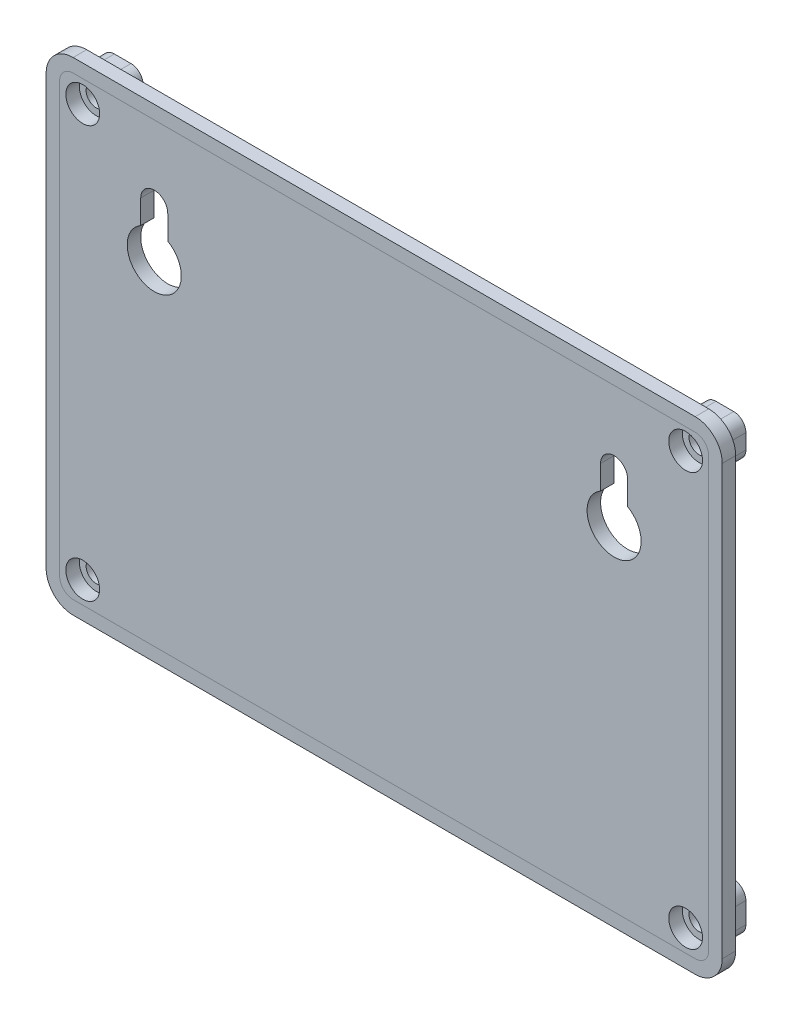
from build123d import *

# Parameters (mm, degrees)
AUFSATZ_LINEAR_AUSTRAGEN1_DEPTH      = 2
SKIZZE4_W                            = 95.25
SKIZZE4_H                            = 66.675
SKIZZE4_W_2                          = 91.25
SKIZZE4_H_2                          = 62.675
LINEAR_AUSTRAGEN_D_NN1_DEPTH         = 2
SKIZZE6_W                            = 6.226087216
SKIZZE6_H                            = 5.839692789
SKIZZE6_W_2                          = 6.057243249
SKIZZE6_H_2                          = 5.496638274
SKIZZE6_W_3                          = 6.955123198
SKIZZE6_H_3                          = 6.71155976
SKIZZE6_W_4                          = 6.922640051
AUFSATZ_LINEAR_AUSTRAGEN2_DEPTH      = 3.9
VERRUNDUNG2_R                        = 1.8
VERRUNDUNG3_R                        = 1.8
VERRUNDUNG4_R                        = 1.8
SKIZZE7_R                            = 1.5
SCHNITT_LINEAR_AUSTRAGEN1_DEPTH      = 6
SKIZZE8_R                            = 2.5
SCHNITT_LINEAR_AUSTRAGEN2_DEPTH      = 2
SKIZZE9_R                            = 4
SCHNITT_LINEAR_AUSTRAGEN3_DEPTH      = 2
SKIZZE10_R                           = 2
SCHNITT_LINEAR_AUSTRAGEN5_DEPTH      = 2
SKIZZE11_W                           = 4
SKIZZE11_H                           = 4.308003348
SCHNITT_LINEAR_AUSTRAGEN6_DEPTH      = 2
SCHNITT_LINEAR_AUSTRAGEN_D_NN1_START = -2
SCHNITT_LINEAR_AUSTRAGEN_D_NN1_DEPTH = 2
LINEAR_AUSTRAGEN_D_NN2_DEPTH         = 2


with BuildPart() as part:
    # Skizze3 → Aufsatz-Linear austragen1 (new body)
    with BuildSketch(Plane.XY):
        with BuildLine():
            Line((-89.26767695, 29.092284131), (-89.26767695, -34.382715869))
            ThreePointArc((-89.26767695, -34.382715869), (-88.096104074, -37.211142994), (-85.26767695, -38.382715869))
            Line((-85.26767695, -38.382715869), (6.78232305, -38.382715869))
            ThreePointArc((6.78232305, -38.382715869), (9.610750175, -37.211142994), (10.78232305, -34.382715869))
            Line((10.78232305, -34.382715869), (10.78232305, 29.092284131))
            ThreePointArc((10.78232305, 29.092284131), (9.610750175, 31.920711255), (6.78232305, 33.092284131))
            Line((6.78232305, 33.092284131), (-85.26767695, 33.092284131))
            ThreePointArc((-85.26767695, 33.092284131), (-88.096104074, 31.920711255), (-89.26767695, 29.092284131))
        make_face()
    extrude(amount=AUFSATZ_LINEAR_AUSTRAGEN1_DEPTH)

    # Skizze4 → Linear-Austragen-Dünn1 (add)
    with BuildSketch(Plane(origin=(0, 0, 0), x_dir=(-1, 0, 0), z_dir=(0, 0, -1))):
        with Locations((39.24267695, -2.645215869)):
            Rectangle(SKIZZE4_W, SKIZZE4_H)
        with Locations((39.24267695, -2.645215869)):
            Rectangle(SKIZZE4_W_2, SKIZZE4_H_2, mode=Mode.SUBTRACT)
    extrude(amount=LINEAR_AUSTRAGEN_D_NN1_DEPTH)

    # Skizze6 → Aufsatz-Linear austragen2 (add)
    with BuildSketch(Plane(origin=(0, 0, 0), x_dir=(-1, 0, 0), z_dir=(0, 0, -1))):
        with Locations((-5.269279442, 27.772437737)):
            Rectangle(SKIZZE6_W, SKIZZE6_H)
        with Locations((83.839055325, 27.943964994)):
            Rectangle(SKIZZE6_W_2, SKIZZE6_H_2)
        with Locations((83.390115351, -32.626935989)):
            Rectangle(SKIZZE6_W_3, SKIZZE6_H_3)
        with Locations((-4.921003025, -32.626935989)):
            Rectangle(SKIZZE6_W_4, SKIZZE6_H_3)
    extrude(amount=AUFSATZ_LINEAR_AUSTRAGEN2_DEPTH)

    # Verrundung2
    verrundung2_edges = [part.edges().sort_by_distance(p)[0] for p in [
        (8.38232305, 30.692284131, -1.95),
        (8.38232305, -35.982715869, -1.95),
        (-86.86767695, -35.982715869, -1.95),
        (-86.86767695, 30.692284131, -1.95),
    ]]
    fillet(verrundung2_edges, radius=VERRUNDUNG2_R)

    # Verrundung3
    verrundung3_edges = [part.edges().sort_by_distance(p)[0] for p in [
        (-79.912553752, -29.271156109, -1.95),
        (1.459682999, -29.271156109, -1.95),
        (2.156235834, 24.852591342, -1.95),
        (-80.810433701, 25.195645857, -1.95),
    ]]
    fillet(verrundung3_edges, radius=VERRUNDUNG3_R)

    # Verrundung4
    verrundung4_edges = [part.edges().sort_by_distance(p)[0] for p in [
        (-86.86767695, -29.271156109, -2.95),
        (-79.912553752, -35.982715869, -2.95),
        (8.38232305, -29.271156109, -2.95),
        (1.459682999, -35.982715869, -2.95),
        (8.38232305, 24.852591342, -2.95),
        (2.156235834, 30.692284131, -2.95),
        (-86.86767695, 25.195645857, -2.95),
        (-80.810433701, 30.692284131, -2.95),
    ]]
    fillet(verrundung4_edges, radius=VERRUNDUNG4_R)

    # Skizze7 → Schnitt-Linear austragen1 (cut)
    with BuildSketch(Plane.XY.offset(2)):
        with Locations((-83.851410283, 27.834784131)):
            Circle(SKIZZE7_R)
        with Locations((5.366089717, 27.993517464)):
            Circle(SKIZZE7_R)
        with Locations((-83.851410283, -33.125215869)):
            Circle(SKIZZE7_R)
        with Locations((5.366089717, -33.125215869)):
            Circle(SKIZZE7_R)
    extrude(amount=-SCHNITT_LINEAR_AUSTRAGEN1_DEPTH, mode=Mode.SUBTRACT)

    # Skizze8 → Schnitt-Linear austragen2 (cut)
    with BuildSketch(Plane.XY.offset(2)):
        with Locations((-83.851410283, 27.834784131)):
            Circle(SKIZZE8_R)
        with Locations((-83.851410283, -33.125215869)):
            Circle(SKIZZE8_R)
        with Locations((5.366089717, -33.125215869)):
            Circle(SKIZZE8_R)
        with Locations((5.366089717, 27.993517464)):
            Circle(SKIZZE8_R)
    extrude(amount=-SCHNITT_LINEAR_AUSTRAGEN2_DEPTH, mode=Mode.SUBTRACT)

    # Skizze9 → Schnitt-Linear austragen3 (cut)
    with BuildSketch(Plane.XY.offset(2)):
        with Locations((-73.26767695, 13.092284131)):
            Circle(SKIZZE9_R)
        with Locations((-5.21767695, 13.092284131)):
            Circle(SKIZZE9_R)
    extrude(amount=-SCHNITT_LINEAR_AUSTRAGEN3_DEPTH, mode=Mode.SUBTRACT)

    # Skizze10 → Schnitt-Linear austragen5 (cut)
    with BuildSketch(Plane.XY.offset(2)):
        with Locations((-73.26767695, 20.092284131)):
            Circle(SKIZZE10_R)
        with Locations((-5.21767695, 20.092284131)):
            Circle(SKIZZE10_R)
    extrude(amount=-SCHNITT_LINEAR_AUSTRAGEN5_DEPTH, mode=Mode.SUBTRACT)

    # Skizze11 → Schnitt-Linear austragen6 (cut)
    with BuildSketch(Plane.XY.offset(2)):
        with Locations((-73.26767695, 17.938282457)):
            Rectangle(SKIZZE11_W, SKIZZE11_H)
        with Locations((-5.21767695, 17.938282457)):
            Rectangle(SKIZZE11_W, SKIZZE11_H)
    extrude(amount=-SCHNITT_LINEAR_AUSTRAGEN6_DEPTH, mode=Mode.SUBTRACT)

    # Skizze12 → Schnitt-Linear-Austragen-Dünn1 (cut)
    with BuildSketch(Plane.XY.offset(2).offset(SCHNITT_LINEAR_AUSTRAGEN_D_NN1_START)):
        with BuildLine():
            Line((6.78232305, 33.092284131), (-85.26767695, 33.092284131))
            ThreePointArc((-85.26767695, 33.092284131), (-88.096104074, 31.920711255), (-89.26767695, 29.092284131))
            Line((-89.26767695, 29.092284131), (-89.26767695, -34.382715869))
            ThreePointArc((-89.26767695, -34.382715869), (-88.096104074, -37.211142994), (-85.26767695, -38.382715869))
            Line((-85.26767695, -38.382715869), (6.78232305, -38.382715869))
            ThreePointArc((6.78232305, -38.382715869), (9.610750175, -37.211142994), (10.78232305, -34.382715869))
            Line((10.78232305, -34.382715869), (10.78232305, 29.092284131))
            ThreePointArc((10.78232305, 29.092284131), (9.610750175, 31.920711255), (6.78232305, 33.092284131))
        make_face()
        with BuildLine():
            Line((6.78232305, 31.092284131), (-85.26767695, 31.092284131))
            ThreePointArc((-85.26767695, 31.092284131), (-86.681890512, 30.506497693), (-87.26767695, 29.092284131))
            Line((-87.26767695, 29.092284131), (-87.26767695, -34.382715869))
            ThreePointArc((-87.26767695, -34.382715869), (-86.681890512, -35.796929432), (-85.26767695, -36.382715869))
            Line((-85.26767695, -36.382715869), (6.78232305, -36.382715869))
            ThreePointArc((6.78232305, -36.382715869), (8.196536613, -35.796929432), (8.78232305, -34.382715869))
            Line((8.78232305, -34.382715869), (8.78232305, 29.092284131))
            ThreePointArc((8.78232305, 29.092284131), (8.196536613, 30.506497693), (6.78232305, 31.092284131))
        make_face(mode=Mode.SUBTRACT)
    extrude(amount=SCHNITT_LINEAR_AUSTRAGEN_D_NN1_DEPTH, mode=Mode.SUBTRACT)


with BuildPart() as body_2:
    # Skizze12<2> → Linear-Austragen-Dünn2 (new body)
    with BuildSketch(Plane.XY.offset(2)):
        with BuildLine():
            Line((6.78232305, 33.092284131), (-85.26767695, 33.092284131))
            ThreePointArc((-85.26767695, 33.092284131), (-88.096104074, 31.920711255), (-89.26767695, 29.092284131))
            Line((-89.26767695, 29.092284131), (-89.26767695, -34.382715869))
            ThreePointArc((-89.26767695, -34.382715869), (-88.096104074, -37.211142994), (-85.26767695, -38.382715869))
            Line((-85.26767695, -38.382715869), (6.78232305, -38.382715869))
            ThreePointArc((6.78232305, -38.382715869), (9.610750175, -37.211142994), (10.78232305, -34.382715869))
            Line((10.78232305, -34.382715869), (10.78232305, 29.092284131))
            ThreePointArc((10.78232305, 29.092284131), (9.610750175, 31.920711255), (6.78232305, 33.092284131))
        make_face()
        with BuildLine():
            Line((6.78232305, 31.092284131), (-85.26767695, 31.092284131))
            ThreePointArc((-85.26767695, 31.092284131), (-86.681890512, 30.506497693), (-87.26767695, 29.092284131))
            Line((-87.26767695, 29.092284131), (-87.26767695, -34.382715869))
            ThreePointArc((-87.26767695, -34.382715869), (-86.681890512, -35.796929432), (-85.26767695, -36.382715869))
            Line((-85.26767695, -36.382715869), (6.78232305, -36.382715869))
            ThreePointArc((6.78232305, -36.382715869), (8.196536613, -35.796929432), (8.78232305, -34.382715869))
            Line((8.78232305, -34.382715869), (8.78232305, 29.092284131))
            ThreePointArc((8.78232305, 29.092284131), (8.196536613, 30.506497693), (6.78232305, 31.092284131))
        make_face(mode=Mode.SUBTRACT)
    extrude(amount=-LINEAR_AUSTRAGEN_D_NN2_DEPTH)


solid = Compound([part.part, body_2.part])
